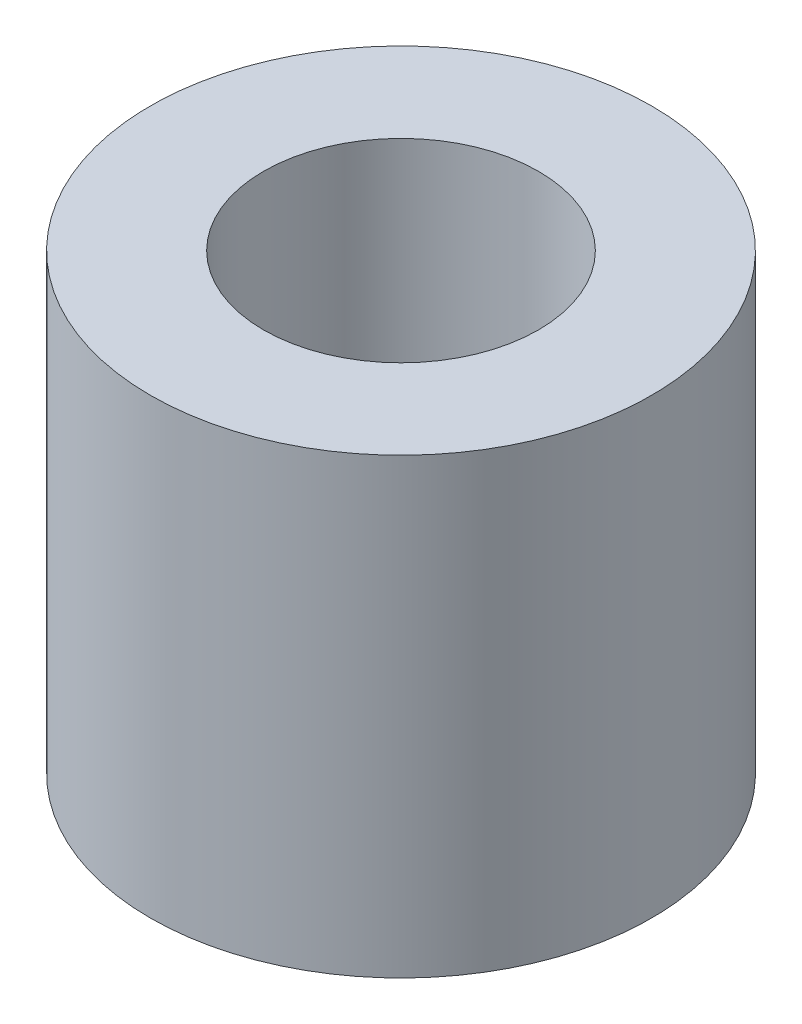
from build123d import *

# Parameters (mm, degrees)
SKETCH1_R           = 3.875
SKETCH1_R_2         = 2.125
BOSS_EXTRUDE1_DEPTH = 7


with BuildPart() as part:
    # Sketch1 → Boss-Extrude1 (new body)
    with BuildSketch(Plane(origin=(0, 0, 0), x_dir=(1, 0, 0), z_dir=(0, 1, 0))):
        with Locations(Location((0, 0, 0), (0, 0, 270))):
            Circle(SKETCH1_R)
        with Locations(Location((0, 0, 0), (0, 0, 270))):
            Circle(SKETCH1_R_2, mode=Mode.SUBTRACT)
    extrude(amount=BOSS_EXTRUDE1_DEPTH)


solid = part.part
